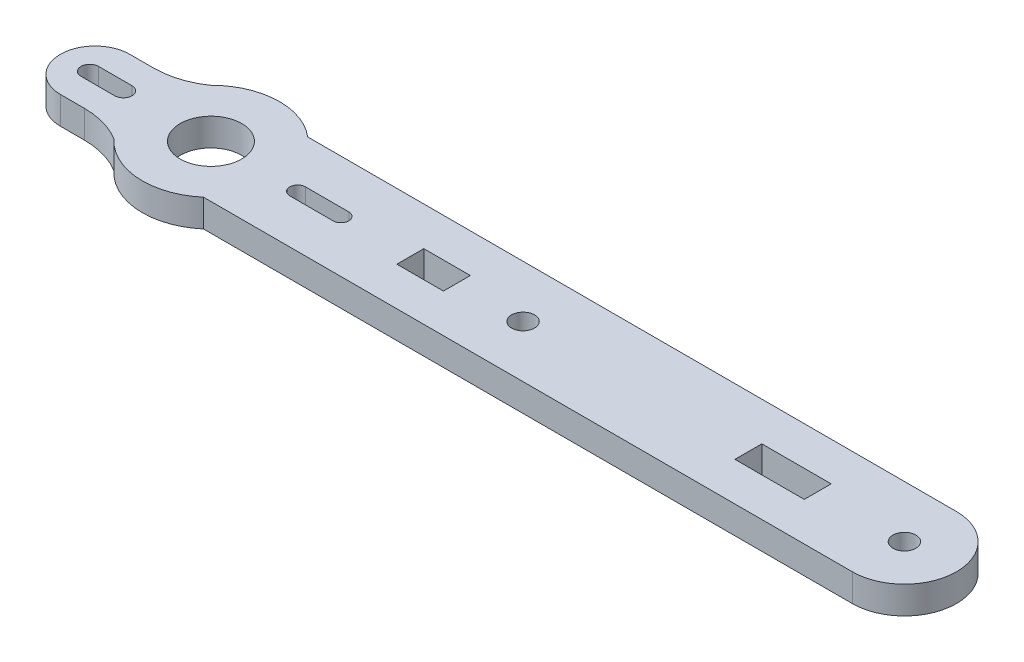
from build123d import *

# Parameters (mm, degrees)
SKETCH1_R           = 1.322622219
SKETCH1_R_2         = 3.543581518
SKETCH1_W           = 5.363642664
SKETCH1_H           = 3.09972609
BOSS_EXTRUDE1_DEPTH = 3.175


with BuildPart() as part:
    # Sketch1 → Boss-Extrude1 (new body)
    with BuildSketch(Plane(origin=(0, 0, 0), x_dir=(1, 0, 0), z_dir=(0, 1, 0))):
        with BuildLine():
            Line((-30.420224954, 6.394505262), (44.302185909, 6.390032423))
            ThreePointArc((44.302185909, 6.390032423), (50.304735151, 0.387483181), (44.302185909, -5.61506606))
            Line((44.302185909, -5.61506606), (-30.420308604, -5.61506606))
            ThreePointArc((-30.420308604, -5.61506606), (-36.033562007, -7.500021548), (-41.380965097, -4.957001462))
            ThreePointArc((-41.380965097, -4.957001462), (-43.672708861, -3.953506377), (-46.150888165, -3.610404055))
            Line((-46.150888165, -3.610404055), (-48.909665253, -3.610404055))
            ThreePointArc((-48.909665253, -3.610404055), (-52.90984424, 0.389774933), (-48.909665253, 4.38995392))
            Line((-48.909665253, 4.38995392), (-46.150888165, 4.38995392))
            ThreePointArc((-46.150888165, 4.38995392), (-43.564402624, 4.780712621), (-41.208786399, 5.918109658))
            ThreePointArc((-41.208786399, 5.918109658), (-35.908549497, 8.286044856), (-30.420224954, 6.394505262))
        make_face()
        with Locations(Location((44.302185909, 0.387483181, 0), (0, 0, 270))):
            Circle(SKETCH1_R, mode=Mode.SUBTRACT)
        with Locations(Location((0.383109325, 0.385153592, 0), (0, 0, 270))):
            Circle(SKETCH1_R, mode=Mode.SUBTRACT)
        with Locations(Location((-35.559869313, 0.389755399, 0), (0, 0, 270))):
            Circle(SKETCH1_R_2, mode=Mode.SUBTRACT)
        Polygon((34.320012777, 1.885218269), (34.320012777, 1.935143597), (26.334122715, 1.935143597), (26.334122715, 1.885218269), (26.334122715, -1.114852491), (26.334122715, -1.164973144), (34.320012777, -1.164973144), (34.320012777, -1.114852491), align=None, mode=Mode.SUBTRACT)
        with Locations((-9.914943428, 0.385085228)):
            Rectangle(SKETCH1_W, SKETCH1_H, mode=Mode.SUBTRACT)
        with BuildLine():
            Line((-20.582664571, -0.514889121), (-25.573840985, -0.514889121))
            ThreePointArc((-25.573840985, -0.514889121), (-26.473815335, 0.385085229), (-25.573840985, 1.285059578))
            Line((-25.573840985, 1.285059578), (-20.582664571, 1.285059578))
            ThreePointArc((-20.582664571, 1.285059578), (-19.682690221, 0.385085229), (-20.582664571, -0.514889121))
        make_face(mode=Mode.SUBTRACT)
        with BuildLine():
            Line((-49.512218616, 1.385222757), (-45.638080248, 1.385222757))
            ThreePointArc((-45.638080248, 1.385222757), (-44.638040384, 0.385182893), (-45.638080248, -0.614856971))
            Line((-45.638080248, -0.614856971), (-49.512218616, -0.614856971))
            ThreePointArc((-49.512218616, -0.614856971), (-50.51225848, 0.385182893), (-49.512218616, 1.385222757))
        make_face(mode=Mode.SUBTRACT)
    extrude(amount=BOSS_EXTRUDE1_DEPTH)


solid = part.part
